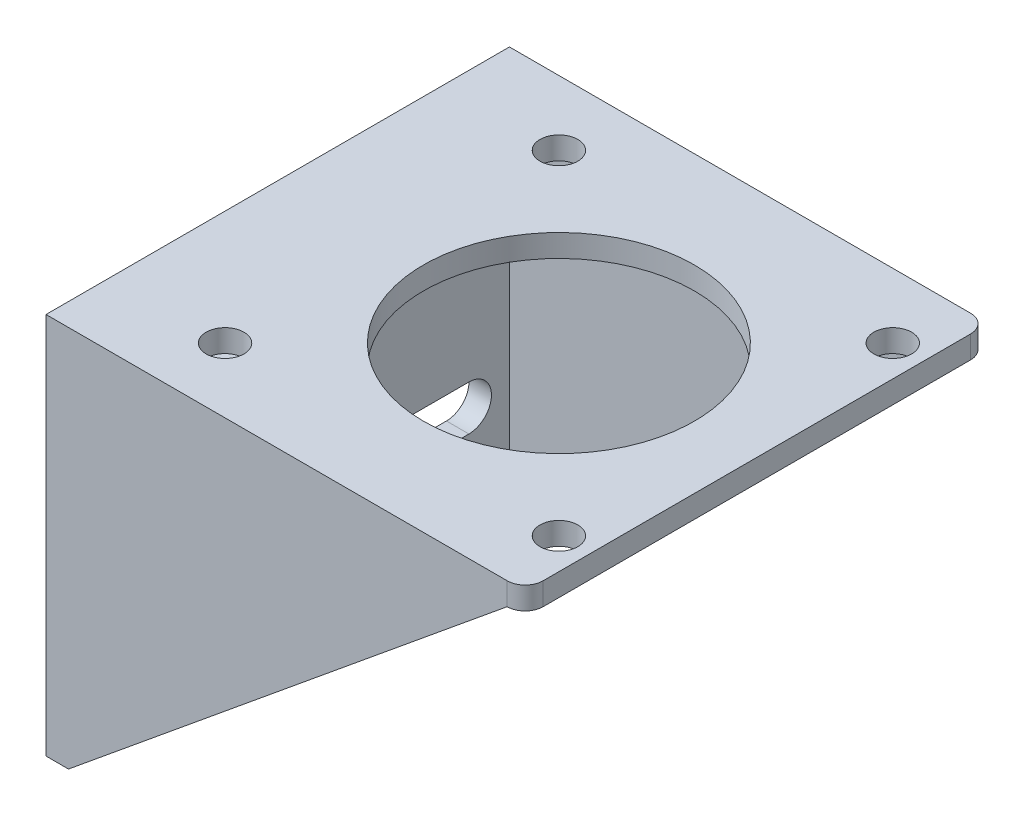
from build123d import *

# Parameters (mm, degrees)
SKETCH1_W           = 67.6275
SKETCH1_H           = 65.405
SKETCH1_R           = 19.1135
SKETCH1_R_2         = 2.667
BOSS_EXTRUDE1_DEPTH = 3.175
FILLET1_R           = 2.54
SKETCH2_W           = 65.405
SKETCH2_H           = 50.8
BOSS_EXTRUDE2_DEPTH = 3.175
BOSS_EXTRUDE5_DEPTH = 3.175
BOSS_EXTRUDE6_DEPTH = 3.175
SKETCH9_R           = 3.175
CUT_EXTRUDE1_DEPTH  = 3.175


with BuildPart() as part:
    # Sketch1 → Boss-Extrude1 (new body)
    with BuildSketch(Plane(origin=(0, 0, 0), x_dir=(1, 0, 0), z_dir=(0, 1, 0))):
        with Locations((-5.87375, 0)):
            Rectangle(SKETCH1_W, SKETCH1_H)
        with Locations(Location((0, 0, 0), (0, 0, 270))):
            Circle(SKETCH1_R, mode=Mode.SUBTRACT)
        with Locations(Location((-23.5585, 23.5585, 0), (0, 0, 270))):
            Circle(SKETCH1_R_2, mode=Mode.SUBTRACT)
        with Locations(Location((23.5585, 23.5585, 0), (0, 0, 270))):
            Circle(SKETCH1_R_2, mode=Mode.SUBTRACT)
        with Locations(Location((-23.5585, -23.5585, 0), (0, 0, 270))):
            Circle(SKETCH1_R_2, mode=Mode.SUBTRACT)
        with Locations(Location((23.5585, -23.5585, 0), (0, 0, 270))):
            Circle(SKETCH1_R_2, mode=Mode.SUBTRACT)
    extrude(amount=BOSS_EXTRUDE1_DEPTH)

    # Fillet1
    fillet1_edges = [part.edges().sort_by_distance(p)[0] for p in [
        (27.94, 1.5875, -32.7025),
        (27.94, 1.5875, 32.7025),
    ]]
    fillet(fillet1_edges, radius=FILLET1_R)

    # Sketch2 → Boss-Extrude2 (add)
    with BuildSketch(Plane.ZY.offset(39.6875)):
        with Locations((0, -25.4)):
            Rectangle(SKETCH2_W, SKETCH2_H)
    extrude(amount=-BOSS_EXTRUDE2_DEPTH)

    # Sketch7 → Boss-Extrude5 (add)
    with BuildSketch(Plane.XY.offset(32.7025)):
        Polygon((-36.5125, -50.8), (25.4, 0), (-36.5125, 0), align=None)
    extrude(amount=-BOSS_EXTRUDE5_DEPTH)

    # Sketch8 → Boss-Extrude6 (add)
    with BuildSketch(Plane(origin=(0, 0, -32.7025), x_dir=(-1, 0, 0), z_dir=(0, 0, -1))):
        Polygon((-25.4, 0), (36.5125, 0), (36.5125, -50.8), align=None)
    extrude(amount=-BOSS_EXTRUDE6_DEPTH)

    # Sketch9 → Cut-Extrude1 (cut)
    with BuildSketch(Plane(origin=(-36.5125, 0, 0), x_dir=(0, 0, -1), z_dir=(1, 0, 0))):
        with BuildLine():
            ThreePointArc((-2.2225, -12.7), (-5.3975, -9.525), (-2.2225, -6.35))
            Line((-2.2225, -6.35), (-12.3825, -6.35))
            ThreePointArc((-12.3825, -6.35), (-10.13743597, -7.27993597), (-9.2075, -9.525))
            ThreePointArc((-9.2075, -9.525), (-10.13743597, -11.77006403), (-12.3825, -12.7))
            Line((-12.3825, -12.7), (-2.2225, -12.7))
        make_face()
        with Locations((-2.2225, -9.525)):
            Circle(SKETCH9_R)
        with Locations((-12.3825, -9.525)):
            Circle(SKETCH9_R)
        with BuildLine():
            ThreePointArc((23.8125, -12.7), (20.6375, -9.525), (23.8125, -6.35))
            Line((23.8125, -6.35), (13.6525, -6.35))
            ThreePointArc((13.6525, -6.35), (15.89756403, -7.27993597), (16.8275, -9.525))
            ThreePointArc((16.8275, -9.525), (15.89756403, -11.77006403), (13.6525, -12.7))
            Line((13.6525, -12.7), (23.8125, -12.7))
        make_face()
        with Locations((13.6525, -9.525)):
            Circle(SKETCH9_R)
        with Locations((23.8125, -9.525)):
            Circle(SKETCH9_R)
        with Locations((23.8125, -34.925)):
            Circle(SKETCH9_R)
        with BuildLine():
            Line((13.6525, -38.1), (23.8125, -38.1))
            ThreePointArc((23.8125, -38.1), (20.6375, -34.925), (23.8125, -31.75))
            Line((23.8125, -31.75), (13.6525, -31.75))
            ThreePointArc((13.6525, -31.75), (15.89756403, -32.67993597), (16.8275, -34.925))
            ThreePointArc((16.8275, -34.925), (15.89756403, -37.17006403), (13.6525, -38.1))
        make_face()
        with Locations((13.6525, -34.925)):
            Circle(SKETCH9_R)
        with Locations((-2.2225, -34.925)):
            Circle(SKETCH9_R)
        with BuildLine():
            ThreePointArc((-2.2225, -38.1), (-5.3975, -34.925), (-2.2225, -31.75))
            Line((-2.2225, -31.75), (-12.3825, -31.75))
            ThreePointArc((-12.3825, -31.75), (-10.13743597, -32.67993597), (-9.2075, -34.925))
            ThreePointArc((-9.2075, -34.925), (-10.13743597, -37.17006403), (-12.3825, -38.1))
            Line((-12.3825, -38.1), (-2.2225, -38.1))
        make_face()
        with Locations((-12.3825, -34.925)):
            Circle(SKETCH9_R)
    extrude(amount=-CUT_EXTRUDE1_DEPTH, mode=Mode.SUBTRACT)


solid = part.part
